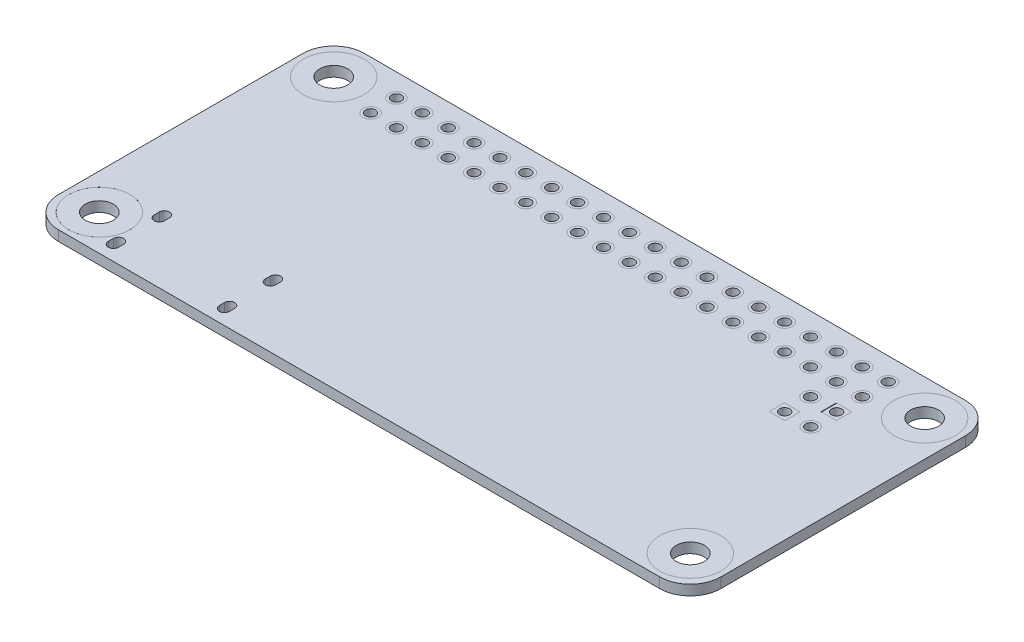
from build123d import *

# Parameters (mm, degrees)
SKETCH1_R             = 3
SKETCH1_R_2           = 0.75
SKETCH1_W             = 1.5
SKETCH1_H             = 1.5
BOSS_EXTRUDE1_DEPTH   = 1
SKETCH2_R             = 0.75
SKETCH2_R_2           = 0.5
BOSS_EXTRUDE2_DEPTH   = 1
LPATTERN2_COUNT       = 20
LPATTERN2_PITCH       = 2.54
LPATTERN2_2_COUNT     = 2
LPATTERN2_2_PITCH     = 2.54
SKETCH3_R             = 0.75
SKETCH3_R_2           = 0.5
BOSS_EXTRUDE3_DEPTH   = 1
BOSS_EXTRUDE3_2_DEPTH = 1
SKETCH3_W             = 1.541222488
SKETCH3_H             = 1.5
BOSS_EXTRUDE3_3_DEPTH = 1
SKETCH3_W_2           = 1.458777511
BOSS_EXTRUDE3_4_DEPTH = 1
SKETCH4_R             = 3
SKETCH4_R_2           = 1.375
BOSS_EXTRUDE4_DEPTH   = 1
CUT_EXTRUDE1_DEPTH    = 1


with BuildPart() as part:
    # Sketch1 → Boss-Extrude1 (new body)
    with BuildSketch(Plane(origin=(0, 0, 0), x_dir=(1, 0, 0), z_dir=(0, 1, 0))):
        with BuildLine():
            Line((-29.5, -15), (29.5, -15))
            ThreePointArc((29.5, -15), (31.621320344, -14.121320344), (32.5, -12))
            Line((32.5, -12), (32.5, 12))
            ThreePointArc((32.5, 12), (31.621320344, 14.121320344), (29.5, 15))
            Line((29.5, 15), (-29.5, 15))
            ThreePointArc((-29.5, 15), (-31.621320344, 14.121320344), (-32.5, 12))
            Line((-32.5, 12), (-32.5, -12))
            ThreePointArc((-32.5, -12), (-31.621320344, -14.121320344), (-29.5, -15))
        make_face()
        with Locations(Location((-29, 11.5, 0), (0, 0, 270))):
            Circle(SKETCH1_R, mode=Mode.SUBTRACT)
        with Locations(Location((-29, -11.5, 0), (0, 0, 270))):
            Circle(SKETCH1_R, mode=Mode.SUBTRACT)
        with Locations(Location((29, -11.5, 0), (0, 0, 90))):
            Circle(SKETCH1_R, mode=Mode.SUBTRACT)
        with Locations(Location((-24.13, 12.787653136, 0), (0, 0, 270))):
            Circle(SKETCH1_R_2, mode=Mode.SUBTRACT)
        with Locations(Location((-21.59, 12.787653136, 0), (0, 0, 270))):
            Circle(SKETCH1_R_2, mode=Mode.SUBTRACT)
        with Locations(Location((-19.05, 12.787653136, 0), (0, 0, 270))):
            Circle(SKETCH1_R_2, mode=Mode.SUBTRACT)
        with Locations(Location((-16.51, 12.787653136, 0), (0, 0, 270))):
            Circle(SKETCH1_R_2, mode=Mode.SUBTRACT)
        with Locations(Location((-13.97, 12.787653136, 0), (0, 0, 270))):
            Circle(SKETCH1_R_2, mode=Mode.SUBTRACT)
        with Locations(Location((-11.43, 12.787653136, 0), (0, 0, 270))):
            Circle(SKETCH1_R_2, mode=Mode.SUBTRACT)
        with Locations(Location((-8.89, 12.787653136, 0), (0, 0, 270))):
            Circle(SKETCH1_R_2, mode=Mode.SUBTRACT)
        with Locations(Location((-6.35, 12.787653136, 0), (0, 0, 270))):
            Circle(SKETCH1_R_2, mode=Mode.SUBTRACT)
        with Locations(Location((-3.81, 12.787653136, 0), (0, 0, 270))):
            Circle(SKETCH1_R_2, mode=Mode.SUBTRACT)
        with Locations(Location((-1.27, 12.787653136, 0), (0, 0, 270))):
            Circle(SKETCH1_R_2, mode=Mode.SUBTRACT)
        with Locations(Location((1.27, 12.787653136, 0), (0, 0, 270))):
            Circle(SKETCH1_R_2, mode=Mode.SUBTRACT)
        with Locations(Location((3.81, 12.787653136, 0), (0, 0, 270))):
            Circle(SKETCH1_R_2, mode=Mode.SUBTRACT)
        with Locations(Location((6.35, 12.787653136, 0), (0, 0, 270))):
            Circle(SKETCH1_R_2, mode=Mode.SUBTRACT)
        with Locations(Location((8.89, 12.787653136, 0), (0, 0, 270))):
            Circle(SKETCH1_R_2, mode=Mode.SUBTRACT)
        with Locations(Location((11.43, 12.787653136, 0), (0, 0, 270))):
            Circle(SKETCH1_R_2, mode=Mode.SUBTRACT)
        with Locations(Location((13.97, 12.787653136, 0), (0, 0, 270))):
            Circle(SKETCH1_R_2, mode=Mode.SUBTRACT)
        with Locations(Location((16.51, 12.787653136, 0), (0, 0, 270))):
            Circle(SKETCH1_R_2, mode=Mode.SUBTRACT)
        with Locations(Location((19.05, 12.787653136, 0), (0, 0, 270))):
            Circle(SKETCH1_R_2, mode=Mode.SUBTRACT)
        with Locations(Location((21.59, 12.787653136, 0), (0, 0, 270))):
            Circle(SKETCH1_R_2, mode=Mode.SUBTRACT)
        with Locations(Location((24.13, 12.787653136, 0), (0, 0, 270))):
            Circle(SKETCH1_R_2, mode=Mode.SUBTRACT)
        with Locations(Location((-21.59, 10.247653136, 0), (0, 0, 270))):
            Circle(SKETCH1_R_2, mode=Mode.SUBTRACT)
        with Locations(Location((-19.05, 10.247653136, 0), (0, 0, 270))):
            Circle(SKETCH1_R_2, mode=Mode.SUBTRACT)
        with Locations(Location((-16.51, 10.247653136, 0), (0, 0, 270))):
            Circle(SKETCH1_R_2, mode=Mode.SUBTRACT)
        with Locations(Location((-13.97, 10.247653136, 0), (0, 0, 270))):
            Circle(SKETCH1_R_2, mode=Mode.SUBTRACT)
        with Locations(Location((-11.43, 10.247653136, 0), (0, 0, 270))):
            Circle(SKETCH1_R_2, mode=Mode.SUBTRACT)
        with Locations(Location((-8.89, 10.247653136, 0), (0, 0, 270))):
            Circle(SKETCH1_R_2, mode=Mode.SUBTRACT)
        with Locations(Location((-6.35, 10.247653136, 0), (0, 0, 270))):
            Circle(SKETCH1_R_2, mode=Mode.SUBTRACT)
        with Locations(Location((-3.81, 10.247653136, 0), (0, 0, 270))):
            Circle(SKETCH1_R_2, mode=Mode.SUBTRACT)
        with Locations(Location((-1.27, 10.247653136, 0), (0, 0, 270))):
            Circle(SKETCH1_R_2, mode=Mode.SUBTRACT)
        with Locations(Location((1.27, 10.247653136, 0), (0, 0, 270))):
            Circle(SKETCH1_R_2, mode=Mode.SUBTRACT)
        with Locations(Location((3.81, 10.247653136, 0), (0, 0, 270))):
            Circle(SKETCH1_R_2, mode=Mode.SUBTRACT)
        with Locations(Location((6.35, 10.247653136, 0), (0, 0, 270))):
            Circle(SKETCH1_R_2, mode=Mode.SUBTRACT)
        with Locations(Location((8.89, 10.247653136, 0), (0, 0, 270))):
            Circle(SKETCH1_R_2, mode=Mode.SUBTRACT)
        with Locations(Location((11.43, 10.247653136, 0), (0, 0, 270))):
            Circle(SKETCH1_R_2, mode=Mode.SUBTRACT)
        with Locations(Location((13.97, 10.247653136, 0), (0, 0, 270))):
            Circle(SKETCH1_R_2, mode=Mode.SUBTRACT)
        with Locations(Location((16.51, 10.247653136, 0), (0, 0, 270))):
            Circle(SKETCH1_R_2, mode=Mode.SUBTRACT)
        with Locations(Location((19.05, 10.247653136, 0), (0, 0, 270))):
            Circle(SKETCH1_R_2, mode=Mode.SUBTRACT)
        with Locations(Location((21.59, 10.247653136, 0), (0, 0, 270))):
            Circle(SKETCH1_R_2, mode=Mode.SUBTRACT)
        with Locations(Location((24.13, 10.247653136, 0), (0, 0, 270))):
            Circle(SKETCH1_R_2, mode=Mode.SUBTRACT)
        with Locations(Location((-24.13, 10.247653136, 0), (0, 0, 270))):
            Circle(SKETCH1_R_2, mode=Mode.SUBTRACT)
        with Locations(Location((21.59002512, 7.707653136, 0), (0, 0, 270))):
            Circle(SKETCH1_R_2, mode=Mode.SUBTRACT)
        with Locations(Location((24.150636364, 5.167736764, 0), (0, 0, 270))):
            Circle(SKETCH1_R_2, mode=Mode.SUBTRACT)
        with Locations(Location((29, 11.5, 0), (0, 0, 270))):
            Circle(SKETCH1_R, mode=Mode.SUBTRACT)
        with Locations((24.13002512, 7.707653136)):
            Rectangle(SKETCH1_W, SKETCH1_H, mode=Mode.SUBTRACT)
        with Locations((21.610636364, 5.167736764)):
            Rectangle(SKETCH1_W, SKETCH1_H, mode=Mode.SUBTRACT)
    extrude(amount=BOSS_EXTRUDE1_DEPTH)

    # Sketch5 → Cut-Extrude1 (cut)
    with BuildSketch(Plane.XZ):
        with BuildLine():
            Line((-26.078842351, 13.039495396), (-26.078842351, 13.539495396))
            ThreePointArc((-26.078842351, 13.539495396), (-25.578842351, 14.039495396), (-25.078842351, 13.539495396))
            Line((-25.078842351, 13.539495396), (-25.078842351, 13.039495396))
            ThreePointArc((-25.078842351, 13.039495396), (-25.578842351, 12.539495396), (-26.078842351, 13.039495396))
        make_face()
        with BuildLine():
            Line((-15.178842351, 13.039495396), (-15.178842351, 13.539495396))
            ThreePointArc((-15.178842351, 13.539495396), (-14.678842351, 14.039495396), (-14.178842351, 13.539495396))
            Line((-14.178842351, 13.539495396), (-14.178842351, 13.039495396))
            ThreePointArc((-14.178842351, 13.039495396), (-14.678842351, 12.539495396), (-15.178842351, 13.039495396))
        make_face()
        with BuildLine():
            Line((-15.178842351, 8.539495396), (-15.178842351, 9.039495396))
            ThreePointArc((-15.178842351, 9.039495396), (-14.678842351, 9.539495396), (-14.178842351, 9.039495396))
            Line((-14.178842351, 9.039495396), (-14.178842351, 8.539495396))
            ThreePointArc((-14.178842351, 8.539495396), (-14.678842351, 8.039495396), (-15.178842351, 8.539495396))
        make_face()
        with BuildLine():
            Line((-26.078842351, 8.539495396), (-26.078842351, 9.039495396))
            ThreePointArc((-26.078842351, 9.039495396), (-25.578842351, 9.539495396), (-25.078842351, 9.039495396))
            Line((-25.078842351, 9.039495396), (-25.078842351, 8.539495396))
            ThreePointArc((-25.078842351, 8.539495396), (-25.578842351, 8.039495396), (-26.078842351, 8.539495396))
        make_face()
    extrude(amount=-CUT_EXTRUDE1_DEPTH, mode=Mode.SUBTRACT)


with BuildPart() as body_2:
    # Sketch2 → Boss-Extrude2 (new body)
    with BuildSketch(Plane(origin=(0, 0, 0), x_dir=(1, 0, 0), z_dir=(0, 1, 0))):
        with Locations(Location((-24.13, 12.787653136, 0), (0, 0, 270))):
            Circle(SKETCH2_R)
        with Locations(Location((-24.13, 12.787653136, 0), (0, 0, 270))):
            Circle(SKETCH2_R_2, mode=Mode.SUBTRACT)
    extrude(amount=BOSS_EXTRUDE2_DEPTH)


with BuildPart() as lpattern2_1:
    # LPattern2: pattern copy
    add(body_2.part.moved(Location(Vector(1, 0, 0) * (1 * LPATTERN2_PITCH))))


with BuildPart() as lpattern2_2:
    # LPattern2: pattern copy
    add(body_2.part.moved(Location(Vector(1, 0, 0) * (2 * LPATTERN2_PITCH))))


with BuildPart() as lpattern2_3:
    # LPattern2: pattern copy
    add(body_2.part.moved(Location(Vector(1, 0, 0) * (3 * LPATTERN2_PITCH))))


with BuildPart() as lpattern2_4:
    # LPattern2: pattern copy
    add(body_2.part.moved(Location(Vector(1, 0, 0) * (4 * LPATTERN2_PITCH))))


with BuildPart() as lpattern2_5:
    # LPattern2: pattern copy
    add(body_2.part.moved(Location(Vector(1, 0, 0) * (5 * LPATTERN2_PITCH))))


with BuildPart() as lpattern2_6:
    # LPattern2: pattern copy
    add(body_2.part.moved(Location(Vector(1, 0, 0) * (6 * LPATTERN2_PITCH))))


with BuildPart() as lpattern2_7:
    # LPattern2: pattern copy
    add(body_2.part.moved(Location(Vector(1, 0, 0) * (7 * LPATTERN2_PITCH))))


with BuildPart() as lpattern2_8:
    # LPattern2: pattern copy
    add(body_2.part.moved(Location(Vector(1, 0, 0) * (8 * LPATTERN2_PITCH))))


with BuildPart() as lpattern2_9:
    # LPattern2: pattern copy
    add(body_2.part.moved(Location(Vector(1, 0, 0) * (9 * LPATTERN2_PITCH))))


with BuildPart() as lpattern2_10:
    # LPattern2: pattern copy
    add(body_2.part.moved(Location(Vector(1, 0, 0) * (10 * LPATTERN2_PITCH))))


with BuildPart() as lpattern2_11:
    # LPattern2: pattern copy
    add(body_2.part.moved(Location(Vector(1, 0, 0) * (11 * LPATTERN2_PITCH))))


with BuildPart() as lpattern2_12:
    # LPattern2: pattern copy
    add(body_2.part.moved(Location(Vector(1, 0, 0) * (12 * LPATTERN2_PITCH))))


with BuildPart() as lpattern2_13:
    # LPattern2: pattern copy
    add(body_2.part.moved(Location(Vector(1, 0, 0) * (13 * LPATTERN2_PITCH))))


with BuildPart() as lpattern2_14:
    # LPattern2: pattern copy
    add(body_2.part.moved(Location(Vector(1, 0, 0) * (14 * LPATTERN2_PITCH))))


with BuildPart() as lpattern2_15:
    # LPattern2: pattern copy
    add(body_2.part.moved(Location(Vector(1, 0, 0) * (15 * LPATTERN2_PITCH))))


with BuildPart() as lpattern2_16:
    # LPattern2: pattern copy
    add(body_2.part.moved(Location(Vector(1, 0, 0) * (16 * LPATTERN2_PITCH))))


with BuildPart() as lpattern2_17:
    # LPattern2: pattern copy
    add(body_2.part.moved(Location(Vector(1, 0, 0) * (17 * LPATTERN2_PITCH))))


with BuildPart() as lpattern2_18:
    # LPattern2: pattern copy
    add(body_2.part.moved(Location(Vector(1, 0, 0) * (18 * LPATTERN2_PITCH))))


with BuildPart() as lpattern2_19:
    # LPattern2: pattern copy
    add(body_2.part.moved(Location(Vector(1, 0, 0) * (19 * LPATTERN2_PITCH))))


with BuildPart() as lpattern2_2_1:
    # LPattern2 2: pattern copy
    add(body_2.part.moved(Location(Vector(0, 0, 1) * (1 * LPATTERN2_2_PITCH))))


with BuildPart() as lpattern2_2_2:
    # LPattern2 2: pattern copy
    add(lpattern2_1.part.moved(Location(Vector(0, 0, 1) * (1 * LPATTERN2_2_PITCH))))


with BuildPart() as lpattern2_2_3:
    # LPattern2 2: pattern copy
    add(lpattern2_2.part.moved(Location(Vector(0, 0, 1) * (1 * LPATTERN2_2_PITCH))))


with BuildPart() as lpattern2_2_4:
    # LPattern2 2: pattern copy
    add(lpattern2_3.part.moved(Location(Vector(0, 0, 1) * (1 * LPATTERN2_2_PITCH))))


with BuildPart() as lpattern2_2_5:
    # LPattern2 2: pattern copy
    add(lpattern2_4.part.moved(Location(Vector(0, 0, 1) * (1 * LPATTERN2_2_PITCH))))


with BuildPart() as lpattern2_2_6:
    # LPattern2 2: pattern copy
    add(lpattern2_5.part.moved(Location(Vector(0, 0, 1) * (1 * LPATTERN2_2_PITCH))))


with BuildPart() as lpattern2_2_7:
    # LPattern2 2: pattern copy
    add(lpattern2_6.part.moved(Location(Vector(0, 0, 1) * (1 * LPATTERN2_2_PITCH))))


with BuildPart() as lpattern2_2_8:
    # LPattern2 2: pattern copy
    add(lpattern2_7.part.moved(Location(Vector(0, 0, 1) * (1 * LPATTERN2_2_PITCH))))


with BuildPart() as lpattern2_2_9:
    # LPattern2 2: pattern copy
    add(lpattern2_8.part.moved(Location(Vector(0, 0, 1) * (1 * LPATTERN2_2_PITCH))))


with BuildPart() as lpattern2_2_10:
    # LPattern2 2: pattern copy
    add(lpattern2_9.part.moved(Location(Vector(0, 0, 1) * (1 * LPATTERN2_2_PITCH))))


with BuildPart() as lpattern2_2_11:
    # LPattern2 2: pattern copy
    add(lpattern2_10.part.moved(Location(Vector(0, 0, 1) * (1 * LPATTERN2_2_PITCH))))


with BuildPart() as lpattern2_2_12:
    # LPattern2 2: pattern copy
    add(lpattern2_11.part.moved(Location(Vector(0, 0, 1) * (1 * LPATTERN2_2_PITCH))))


with BuildPart() as lpattern2_2_13:
    # LPattern2 2: pattern copy
    add(lpattern2_12.part.moved(Location(Vector(0, 0, 1) * (1 * LPATTERN2_2_PITCH))))


with BuildPart() as lpattern2_2_14:
    # LPattern2 2: pattern copy
    add(lpattern2_13.part.moved(Location(Vector(0, 0, 1) * (1 * LPATTERN2_2_PITCH))))


with BuildPart() as lpattern2_2_15:
    # LPattern2 2: pattern copy
    add(lpattern2_14.part.moved(Location(Vector(0, 0, 1) * (1 * LPATTERN2_2_PITCH))))


with BuildPart() as lpattern2_2_16:
    # LPattern2 2: pattern copy
    add(lpattern2_15.part.moved(Location(Vector(0, 0, 1) * (1 * LPATTERN2_2_PITCH))))


with BuildPart() as lpattern2_2_17:
    # LPattern2 2: pattern copy
    add(lpattern2_16.part.moved(Location(Vector(0, 0, 1) * (1 * LPATTERN2_2_PITCH))))


with BuildPart() as lpattern2_2_18:
    # LPattern2 2: pattern copy
    add(lpattern2_17.part.moved(Location(Vector(0, 0, 1) * (1 * LPATTERN2_2_PITCH))))


with BuildPart() as lpattern2_2_19:
    # LPattern2 2: pattern copy
    add(lpattern2_18.part.moved(Location(Vector(0, 0, 1) * (1 * LPATTERN2_2_PITCH))))


with BuildPart() as lpattern2_2_20:
    # LPattern2 2: pattern copy
    add(lpattern2_19.part.moved(Location(Vector(0, 0, 1) * (1 * LPATTERN2_2_PITCH))))


with BuildPart() as body_42:
    # Sketch3 → Boss-Extrude3 (new body)
    with BuildSketch(Plane(origin=(0, 0, 0), x_dir=(1, 0, 0), z_dir=(0, 1, 0))):
        with Locations(Location((21.59002512, 7.707653136, 0), (0, 0, 270))):
            Circle(SKETCH3_R)
        with Locations(Location((21.59002512, 7.707653136, 0), (0, 0, 270))):
            Circle(SKETCH3_R_2, mode=Mode.SUBTRACT)
    extrude(amount=BOSS_EXTRUDE3_DEPTH)


with BuildPart() as body_43:
    # Sketch3 → Boss-Extrude3 2 (new body)
    with BuildSketch(Plane(origin=(0, 0, 0), x_dir=(1, 0, 0), z_dir=(0, 1, 0))):
        with Locations(Location((24.150636364, 5.167736764, 0), (0, 0, 270))):
            Circle(SKETCH3_R)
        with Locations(Location((24.150636364, 5.167736764, 0), (0, 0, 270))):
            Circle(SKETCH3_R_2, mode=Mode.SUBTRACT)
    extrude(amount=BOSS_EXTRUDE3_2_DEPTH)


with BuildPart() as body_44:
    # Sketch3 → Boss-Extrude3 3 (new body)
    with BuildSketch(Plane(origin=(0, 0, 0), x_dir=(1, 0, 0), z_dir=(0, 1, 0))):
        with Locations((21.59002512, 5.167736764)):
            Rectangle(SKETCH3_W, SKETCH3_H)
        with Locations(Location((21.59002512, 5.167736764, 0), (0, 0, 270))):
            Circle(SKETCH3_R_2, mode=Mode.SUBTRACT)
    extrude(amount=BOSS_EXTRUDE3_3_DEPTH)


with BuildPart() as body_45:
    # Sketch3 → Boss-Extrude3 4 (new body)
    with BuildSketch(Plane(origin=(0, 0, 0), x_dir=(1, 0, 0), z_dir=(0, 1, 0))):
        with Locations((24.150636365, 7.707653136)):
            Rectangle(SKETCH3_W_2, SKETCH3_H)
        with Locations(Location((24.150636364, 7.707653136, 0), (0, 0, 270))):
            Circle(SKETCH3_R_2, mode=Mode.SUBTRACT)
    extrude(amount=BOSS_EXTRUDE3_4_DEPTH)


with BuildPart() as body_46:
    # Sketch4 → Boss-Extrude4 (new body)
    with BuildSketch(Plane(origin=(0, 0, 0), x_dir=(1, 0, 0), z_dir=(0, 1, 0))):
        with Locations(Location((-29, 11.5, 0), (0, 0, 270))):
            Circle(SKETCH4_R)
        with Locations(Location((-29, 11.5, 0), (0, 0, 270))):
            Circle(SKETCH4_R_2, mode=Mode.SUBTRACT)
    extrude(amount=BOSS_EXTRUDE4_DEPTH)


with BuildPart() as body_47:
    # Mirror1: mirrored copy
    add(body_46.part.mirror(Plane(origin=(0, 0, 0), x_dir=(0, 0, 1), z_dir=(1, 0, 0))))


with BuildPart() as body_48:
    # Mirror2: mirrored copy
    add(body_46.part.mirror(Plane.XY))


with BuildPart() as body_49:
    # Mirror2 2: mirrored copy
    add(body_47.part.mirror(Plane.XY))


solid = Compound([part.part, body_2.part, lpattern2_1.part, lpattern2_2.part, lpattern2_3.part, lpattern2_4.part, lpattern2_5.part, lpattern2_6.part, lpattern2_7.part, lpattern2_8.part, lpattern2_9.part, lpattern2_10.part, lpattern2_11.part, lpattern2_12.part, lpattern2_13.part, lpattern2_14.part, lpattern2_15.part, lpattern2_16.part, lpattern2_17.part, lpattern2_18.part, lpattern2_19.part, lpattern2_2_1.part, lpattern2_2_2.part, lpattern2_2_3.part, lpattern2_2_4.part, lpattern2_2_5.part, lpattern2_2_6.part, lpattern2_2_7.part, lpattern2_2_8.part, lpattern2_2_9.part, lpattern2_2_10.part, lpattern2_2_11.part, lpattern2_2_12.part, lpattern2_2_13.part, lpattern2_2_14.part, lpattern2_2_15.part, lpattern2_2_16.part, lpattern2_2_17.part, lpattern2_2_18.part, lpattern2_2_19.part, lpattern2_2_20.part, body_42.part, body_43.part, body_44.part, body_45.part, body_46.part, body_47.part, body_48.part, body_49.part])
